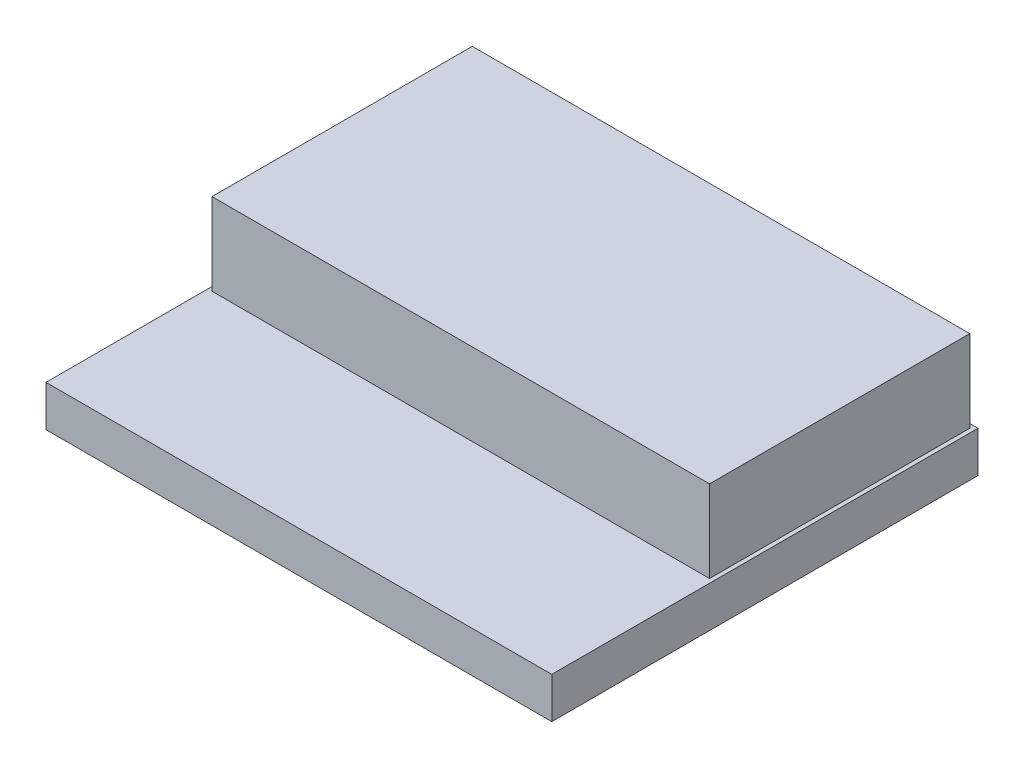
from build123d import *

# Parameters (mm, degrees)
SKETCH1_W           = 12.34
SKETCH1_H           = 10.4
BOSS_EXTRUDE1_DEPTH = 1
SKETCH2_W           = 12.14
SKETCH2_H           = 6.35
BOSS_EXTRUDE2_DEPTH = 2
SKETCH3_W           = 4.6
SKETCH3_H           = 2.66
BOSS_EXTRUDE3_DEPTH = 1


with BuildPart() as part:
    # Sketch1 → Boss-Extrude1 (new body)
    with BuildSketch(Plane(origin=(0, 0, 0), x_dir=(1, 0, 0), z_dir=(0, 1, 0))):
        Rectangle(SKETCH1_W, SKETCH1_H)
    extrude(amount=BOSS_EXTRUDE1_DEPTH)

    # Sketch2 → Boss-Extrude2 (add)
    with BuildSketch(Plane(origin=(0, 1, 0), x_dir=(1, 0, 0), z_dir=(0, 1, 0))):
        with Locations((0, 1.925)):
            Rectangle(SKETCH2_W, SKETCH2_H)
    extrude(amount=BOSS_EXTRUDE2_DEPTH)

    # Sketch3 → Boss-Extrude3 (add)
    with BuildSketch(Plane.XZ):
        Rectangle(SKETCH3_W, SKETCH3_H)
    extrude(amount=BOSS_EXTRUDE3_DEPTH)


solid = part.part
